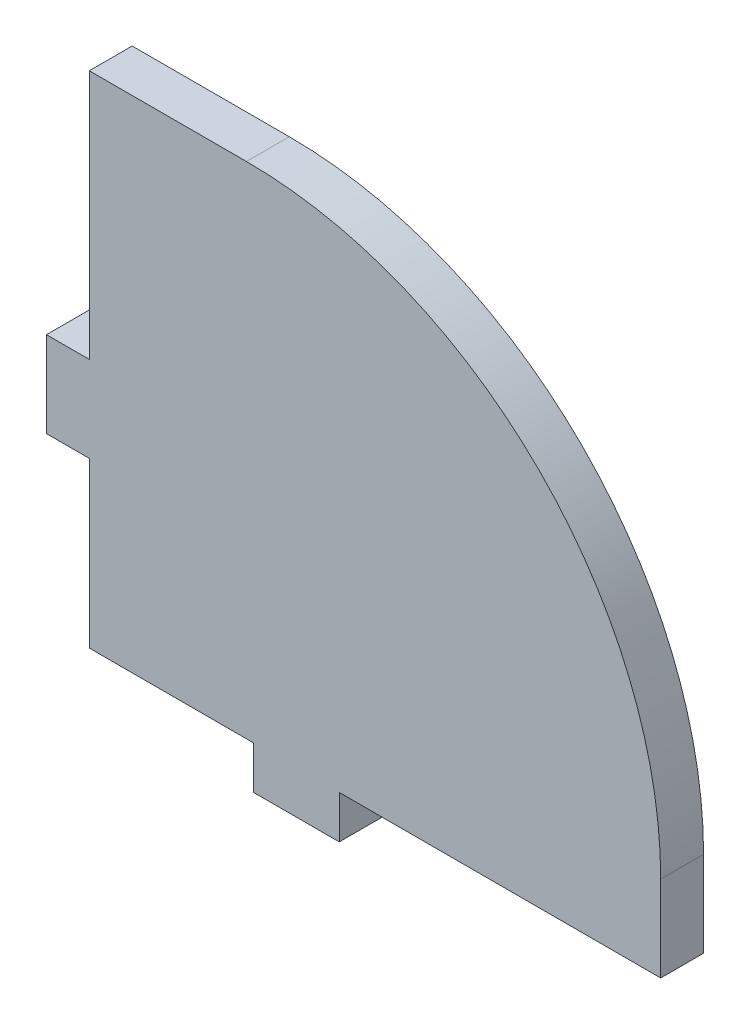
from build123d import *

# Parameters (mm, degrees)
EXTRUDE_1_DEPTH = 3


with BuildPart() as part:
    # 草图1 → 凸台-拉伸1 (new body)
    with BuildSketch(Plane.XY):
        with BuildLine():
            Line((0, 17.5), (-3, 17.5))
            Line((-3, 17.5), (-3, 11.5))
            Line((-3, 11.5), (0, 11.5))
            Line((0, 11.5), (0, 0))
            Line((0, 0), (11.5, 0))
            Line((11.5, 0), (11.5, -3))
            Line((11.5, -3), (17.5, -3))
            Line((17.5, -3), (17.5, 0))
            Line((17.5, 0), (40, 0))
            Line((40, 0), (40, 6))
            ThreePointArc((40, 6), (31.506096654, 26.506096654), (11, 35))
            Line((11, 35), (0, 35))
            Line((0, 35), (0, 17.5))
        make_face()
    extrude(amount=EXTRUDE_1_DEPTH)


solid = part.part
